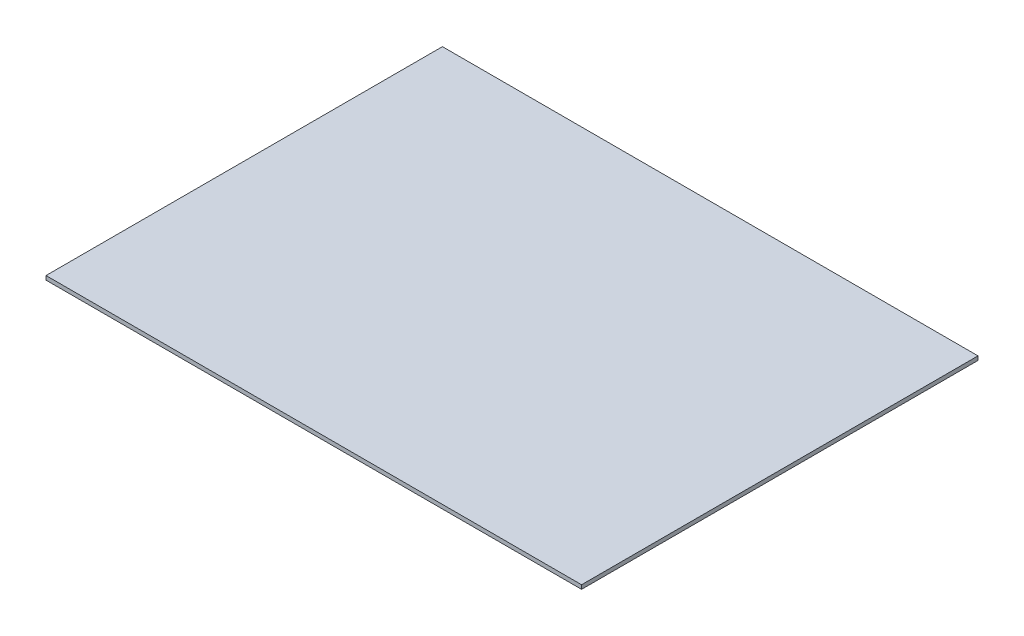
from build123d import *

# Parameters (mm, degrees)
SKICA1_W                = 535
SKICA1_H                = 396
P_IDAT_VYSUNUT_M1_DEPTH = 4


with BuildPart() as part:
    # Skica1 → Přidat vysunutím1 (new body)
    with BuildSketch(Plane(origin=(0, 0, 0), x_dir=(1, 0, 0), z_dir=(0, 1, 0))):
        Rectangle(SKICA1_W, SKICA1_H)
    extrude(amount=P_IDAT_VYSUNUT_M1_DEPTH)


solid = part.part
